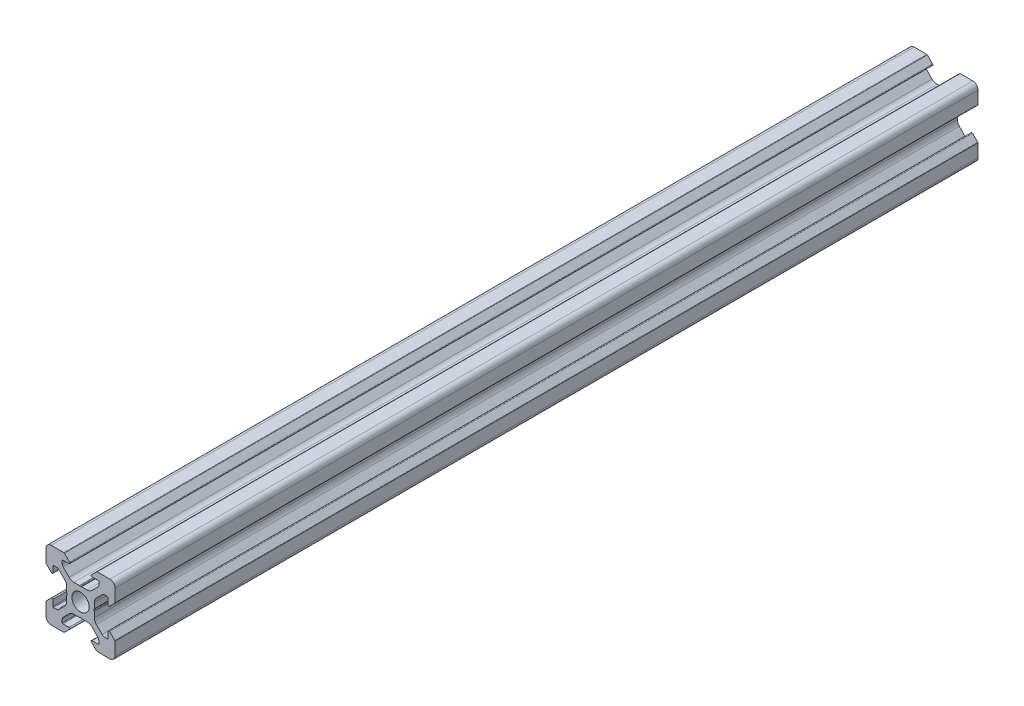
from build123d import *

# Parameters (mm, degrees)
SKETCH_181_R      = 2.5
EXTRUDE_724_DEPTH = 250


with BuildPart() as part:
    # Sketch 181 → Extrude 724 (new body)
    with BuildSketch(Plane.XY):
        with BuildLine():
            Line((-4, 1.898780669), (-4, 0.337695265))
            ThreePointArc((-4, 0.337695265), (-3.98590708, 0.254943529), (-3.945217202, 0.181521503))
            Line((-3.945217202, 0.181521503), (-3.8, 0))
            Line((-3.8, 0), (-3.945217202, -0.181521503))
            ThreePointArc((-3.945217202, -0.181521503), (-3.98590708, -0.254943529), (-4, -0.337695265))
            Line((-4, -0.337695265), (-4, -1.898780669))
            ThreePointArc((-4, -1.898780669), (-4.152240935, -2.664147534), (-4.585786438, -3.312994231))
            Line((-4.585786438, -3.312994231), (-6.279898987, -5.007106781))
            ThreePointArc((-6.279898987, -5.007106781), (-6.604322336, -5.223879533), (-6.987005769, -5.3))
            Line((-6.987005769, -5.3), (-7.8, -5.3))
            ThreePointArc((-7.8, -5.3), (-7.941421356, -5.241421356), (-8, -5.1))
            Line((-8, -5.1), (-8, -3.33))
            ThreePointArc((-8, -3.33), (-8.154329142, -3.099030117), (-8.426776695, -3.153223305))
            Line((-8.426776695, -3.153223305), (-9.926776695, -4.653223305))
            ThreePointArc((-9.926776695, -4.653223305), (-9.980969883, -4.734329142), (-10, -4.83))
            Line((-10, -4.83), (-10, -8.5))
            ThreePointArc((-10, -8.5), (-9.560660172, -9.560660172), (-8.5, -10))
            Line((-8.5, -10), (-4.83, -10))
            ThreePointArc((-4.83, -10), (-4.734329142, -9.980969883), (-4.653223305, -9.926776695))
            Line((-4.653223305, -9.926776695), (-3.153223305, -8.426776695))
            ThreePointArc((-3.153223305, -8.426776695), (-3.099030117, -8.154329142), (-3.33, -8))
            Line((-3.33, -8), (-5.1, -8))
            ThreePointArc((-5.1, -8), (-5.241421356, -7.941421356), (-5.3, -7.8))
            Line((-5.3, -7.8), (-5.3, -6.987005769))
            ThreePointArc((-5.3, -6.987005769), (-5.223879533, -6.604322336), (-5.007106781, -6.279898987))
            Line((-5.007106781, -6.279898987), (-3.312994231, -4.585786438))
            ThreePointArc((-3.312994231, -4.585786438), (-2.664147534, -4.152240935), (-1.898780669, -4))
            Line((-1.898780669, -4), (-0.337695265, -4))
            ThreePointArc((-0.337695265, -4), (-0.254943529, -3.98590708), (-0.181521503, -3.945217202))
            Line((-0.181521503, -3.945217202), (0, -3.8))
            Line((0, -3.8), (0.181521503, -3.945217202))
            ThreePointArc((0.181521503, -3.945217202), (0.254943529, -3.98590708), (0.337695265, -4))
            Line((0.337695265, -4), (1.898780669, -4))
            ThreePointArc((1.898780669, -4), (2.664147534, -4.152240935), (3.312994231, -4.585786438))
            Line((3.312994231, -4.585786438), (5.007106781, -6.279898987))
            ThreePointArc((5.007106781, -6.279898987), (5.223879533, -6.604322336), (5.3, -6.987005769))
            Line((5.3, -6.987005769), (5.3, -7.8))
            ThreePointArc((5.3, -7.8), (5.241421356, -7.941421356), (5.1, -8))
            Line((5.1, -8), (3.33, -8))
            ThreePointArc((3.33, -8), (3.099030117, -8.154329142), (3.153223305, -8.426776695))
            Line((3.153223305, -8.426776695), (4.653223305, -9.926776695))
            ThreePointArc((4.653223305, -9.926776695), (4.734329142, -9.980969883), (4.83, -10))
            Line((4.83, -10), (8.5, -10))
            ThreePointArc((8.5, -10), (9.560660172, -9.560660172), (10, -8.5))
            Line((10, -8.5), (10, -4.83))
            ThreePointArc((10, -4.83), (9.980969883, -4.734329142), (9.926776695, -4.653223305))
            Line((9.926776695, -4.653223305), (8.426776695, -3.153223305))
            ThreePointArc((8.426776695, -3.153223305), (8.154329142, -3.099030117), (8, -3.33))
            Line((8, -3.33), (8, -5.1))
            ThreePointArc((8, -5.1), (7.941421356, -5.241421356), (7.8, -5.3))
            Line((7.8, -5.3), (6.987005769, -5.3))
            ThreePointArc((6.987005769, -5.3), (6.604322336, -5.223879533), (6.279898987, -5.007106781))
            Line((6.279898987, -5.007106781), (4.585786438, -3.312994231))
            ThreePointArc((4.585786438, -3.312994231), (4.152240935, -2.664147534), (4, -1.898780669))
            Line((4, -1.898780669), (4, -0.337695265))
            ThreePointArc((4, -0.337695265), (3.98590708, -0.254943529), (3.945217202, -0.181521503))
            Line((3.945217202, -0.181521503), (3.8, 0))
            Line((3.8, 0), (3.945217202, 0.181521503))
            ThreePointArc((3.945217202, 0.181521503), (3.98590708, 0.254943529), (4, 0.337695265))
            Line((4, 0.337695265), (4, 1.898780669))
            ThreePointArc((4, 1.898780669), (4.152240935, 2.664147534), (4.585786438, 3.312994231))
            Line((4.585786438, 3.312994231), (6.279898987, 5.007106781))
            ThreePointArc((6.279898987, 5.007106781), (6.604322336, 5.223879533), (6.987005769, 5.3))
            Line((6.987005769, 5.3), (7.8, 5.3))
            ThreePointArc((7.8, 5.3), (7.941421356, 5.241421356), (8, 5.1))
            Line((8, 5.1), (8, 3.33))
            ThreePointArc((8, 3.33), (8.154329142, 3.099030117), (8.426776695, 3.153223305))
            Line((8.426776695, 3.153223305), (9.926776695, 4.653223305))
            ThreePointArc((9.926776695, 4.653223305), (9.980969883, 4.734329142), (10, 4.83))
            Line((10, 4.83), (10, 8.5))
            ThreePointArc((10, 8.5), (9.560660172, 9.560660172), (8.5, 10))
            Line((8.5, 10), (4.83, 10))
            ThreePointArc((4.83, 10), (4.734329142, 9.980969883), (4.653223305, 9.926776695))
            Line((4.653223305, 9.926776695), (3.153223305, 8.426776695))
            ThreePointArc((3.153223305, 8.426776695), (3.099030117, 8.154329142), (3.33, 8))
            Line((3.33, 8), (5.1, 8))
            ThreePointArc((5.1, 8), (5.241421356, 7.941421356), (5.3, 7.8))
            Line((5.3, 7.8), (5.3, 6.987005769))
            ThreePointArc((5.3, 6.987005769), (5.223879533, 6.604322336), (5.007106781, 6.279898987))
            Line((5.007106781, 6.279898987), (3.312994231, 4.585786438))
            ThreePointArc((3.312994231, 4.585786438), (2.664147534, 4.152240935), (1.898780669, 4))
            Line((1.898780669, 4), (0.337695265, 4))
            ThreePointArc((0.337695265, 4), (0.254943529, 3.98590708), (0.181521503, 3.945217202))
            Line((0.181521503, 3.945217202), (0, 3.8))
            Line((0, 3.8), (-0.181521503, 3.945217202))
            ThreePointArc((-0.181521503, 3.945217202), (-0.254943529, 3.98590708), (-0.337695265, 4))
            Line((-0.337695265, 4), (-1.898780669, 4))
            ThreePointArc((-1.898780669, 4), (-2.664147534, 4.152240935), (-3.312994231, 4.585786438))
            Line((-3.312994231, 4.585786438), (-5.007106781, 6.279898987))
            ThreePointArc((-5.007106781, 6.279898987), (-5.223879533, 6.604322336), (-5.3, 6.987005769))
            Line((-5.3, 6.987005769), (-5.3, 7.8))
            ThreePointArc((-5.3, 7.8), (-5.241421356, 7.941421356), (-5.1, 8))
            Line((-5.1, 8), (-3.33, 8))
            ThreePointArc((-3.33, 8), (-3.099030117, 8.154329142), (-3.153223305, 8.426776695))
            Line((-3.153223305, 8.426776695), (-4.653223305, 9.926776695))
            ThreePointArc((-4.653223305, 9.926776695), (-4.734329142, 9.980969883), (-4.83, 10))
            Line((-4.83, 10), (-8.5, 10))
            ThreePointArc((-8.5, 10), (-9.560660172, 9.560660172), (-10, 8.5))
            Line((-10, 8.5), (-10, 4.83))
            ThreePointArc((-10, 4.83), (-9.980969883, 4.734329142), (-9.926776695, 4.653223305))
            Line((-9.926776695, 4.653223305), (-8.426776695, 3.153223305))
            ThreePointArc((-8.426776695, 3.153223305), (-8.154329142, 3.099030117), (-8, 3.33))
            Line((-8, 3.33), (-8, 5.1))
            ThreePointArc((-8, 5.1), (-7.941421356, 5.241421356), (-7.8, 5.3))
            Line((-7.8, 5.3), (-6.987005769, 5.3))
            ThreePointArc((-6.987005769, 5.3), (-6.604322336, 5.223879533), (-6.279898987, 5.007106781))
            Line((-6.279898987, 5.007106781), (-4.585786438, 3.312994231))
            ThreePointArc((-4.585786438, 3.312994231), (-4.152240935, 2.664147534), (-4, 1.898780669))
        make_face()
        with Locations(Location((0, 0, 0), (0, 0, 180))):
            Circle(SKETCH_181_R, mode=Mode.SUBTRACT)
    extrude(amount=-EXTRUDE_724_DEPTH)


solid = part.part
